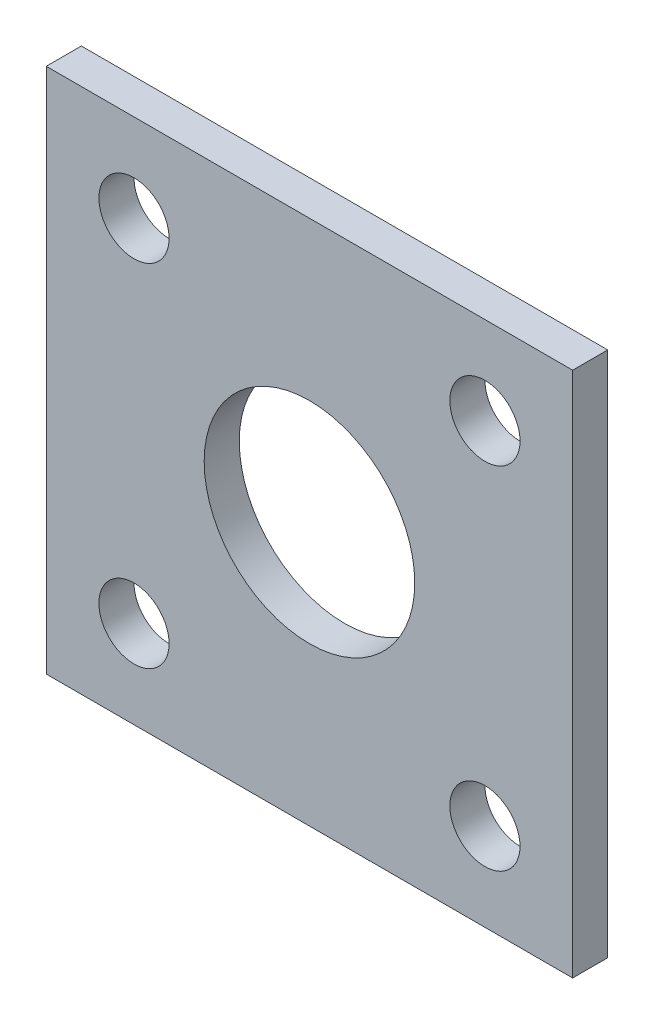
from build123d import *

# Parameters (mm, degrees)
SKETCH1_W           = 1500
SKETCH1_H           = 1500
SKETCH1_R           = 300
SKETCH1_R_2         = 100
BOSS_EXTRUDE1_DEPTH = 100


with BuildPart() as part:
    # Sketch1 → Boss-Extrude1 (new body)
    with BuildSketch(Plane.XY):
        Rectangle(SKETCH1_W, SKETCH1_H)
        Circle(SKETCH1_R, mode=Mode.SUBTRACT)
        with Locations((-500, 500)):
            Circle(SKETCH1_R_2, mode=Mode.SUBTRACT)
        with Locations((500, 500)):
            Circle(SKETCH1_R_2, mode=Mode.SUBTRACT)
        with Locations((500, -500)):
            Circle(SKETCH1_R_2, mode=Mode.SUBTRACT)
        with Locations((-500, -500)):
            Circle(SKETCH1_R_2, mode=Mode.SUBTRACT)
    extrude(amount=BOSS_EXTRUDE1_DEPTH)


solid = part.part
